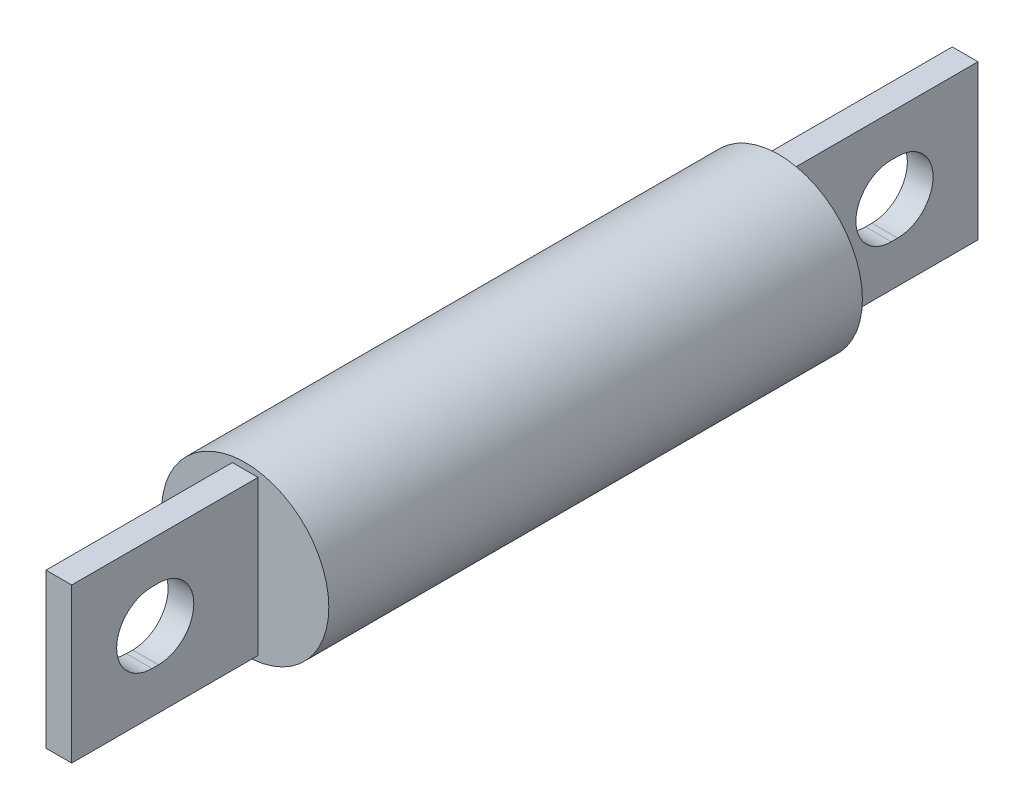
from build123d import *

# Parameters (mm, degrees)
SKETCH1_R           = 10.325
BOSS_EXTRUDE1_DEPTH = 32.9438
SKETCH2_W           = 23.0124
SKETCH2_H           = 19.05
BOSS_EXTRUDE2_DEPTH = 1.5875


with BuildPart() as part:
    # Sketch1 → Boss-Extrude1 (new, symmetric)
    with BuildSketch(Plane.XY):
        Circle(SKETCH1_R)
    extrude(amount=BOSS_EXTRUDE1_DEPTH, both=True)

    # Sketch2 → Boss-Extrude2 (add, symmetric)
    # profile 1 of 2: a face of its own
    with BuildSketch(Plane(origin=(0, 0, 0), x_dir=(0, 0, -1), z_dir=(1, 0, 0))):
        with Locations((-44.45, 0)):
            Rectangle(SKETCH2_W, SKETCH2_H)
        with BuildLine():
            Line((-45.2501, 4.3688), (-46.0375, 4.3688))
            ThreePointArc((-46.0375, 4.3688), (-50.4063, 0), (-46.0375, -4.3688))
            Line((-46.0375, -4.3688), (-45.2501, -4.3688))
            ThreePointArc((-45.2501, -4.3688), (-40.8813, 0), (-45.2501, 4.3688))
        make_face(mode=Mode.SUBTRACT)
    # profile 2 of 2: a face of its own
    with BuildSketch(Plane(origin=(0, 0, 0), x_dir=(0, 0, -1), z_dir=(1, 0, 0))):
        with Locations((44.45, 0)):
            Rectangle(SKETCH2_W, SKETCH2_H)
        with BuildLine():
            Line((45.2501, -4.3688), (46.0375, -4.3688))
            ThreePointArc((46.0375, -4.3688), (50.4063, 0), (46.0375, 4.3688))
            Line((46.0375, 4.3688), (45.2501, 4.3688))
            ThreePointArc((45.2501, 4.3688), (40.8813, 0), (45.2501, -4.3688))
        make_face(mode=Mode.SUBTRACT)
    extrude(amount=BOSS_EXTRUDE2_DEPTH, both=True)


solid = part.part
